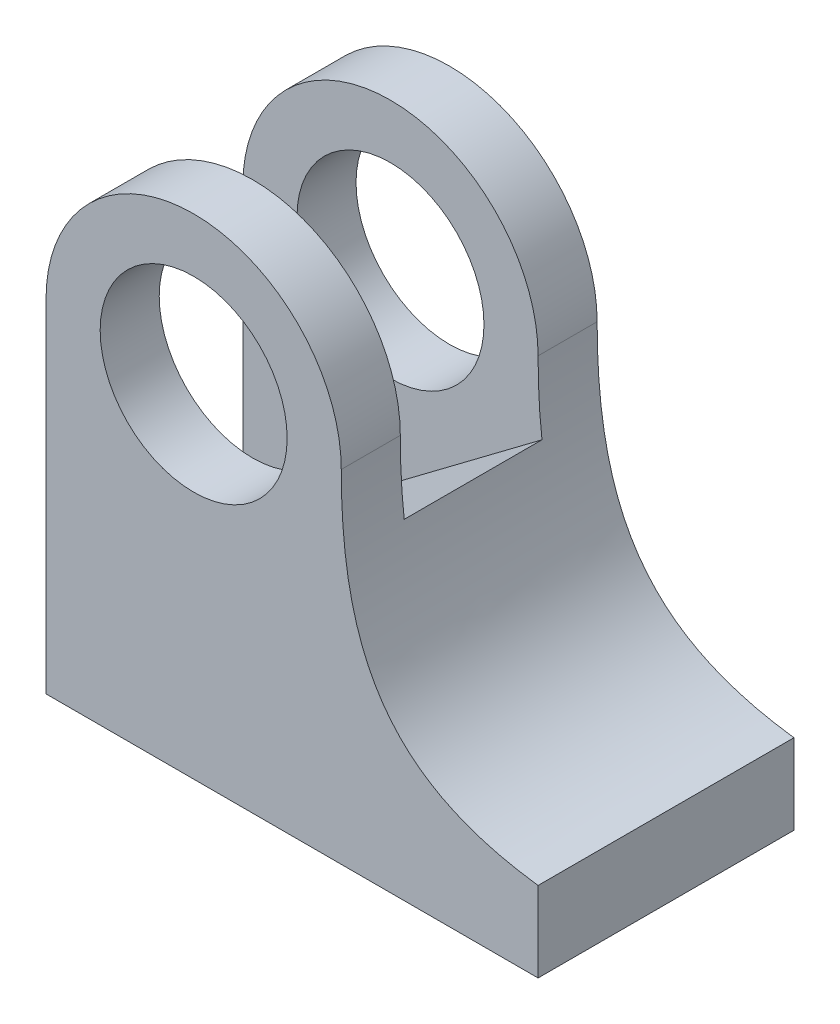
from build123d import *

# Parameters (mm, degrees)
SKETCH1_R           = 9.5
BOSS_EXTRUDE1_DEPTH = 26
SKETCH5_W           = 14
SKETCH5_H           = 30
CUT_EXTRUDE2_DEPTH  = 57


with BuildPart() as part:
    # Sketch1 → Boss-Extrude1 (new body)
    with BuildSketch(Plane.XY):
        with BuildLine():
            Line((-15, 0), (-15, -34.753782032))
            Line((-15, -34.753782032), (35, -34.753782032))
            Line((35, -34.753782032), (35, -26.607408272))
            add(Edge.make_bspline(
                [(35, -26.607408272), (19.62178197, -24.621800081), (15, -15.829616288), (15, 0)],
                knots=[0, 0, 0, 0, 1, 1, 1, 1], degree=3))
            ThreePointArc((15, 0), (0, 15), (-15, 0))
        make_face()
        with Locations(Location((0, 0, 0), (0, 0, 180))):
            Circle(SKETCH1_R, mode=Mode.SUBTRACT)
    extrude(amount=BOSS_EXTRUDE1_DEPTH)

    # Sketch5 → Cut-Extrude2 (cut)
    with BuildSketch(Plane(origin=(17.578199992, 13.213011814, 0), x_dir=(0, 0, -1), z_dir=(0.7993586418199494, 0.6008541934178091, -6.982962677686267e-15))):
        with Locations((-13, 0)):
            Rectangle(SKETCH5_W, SKETCH5_H)
    extrude(amount=-CUT_EXTRUDE2_DEPTH, mode=Mode.SUBTRACT)


solid = part.part
